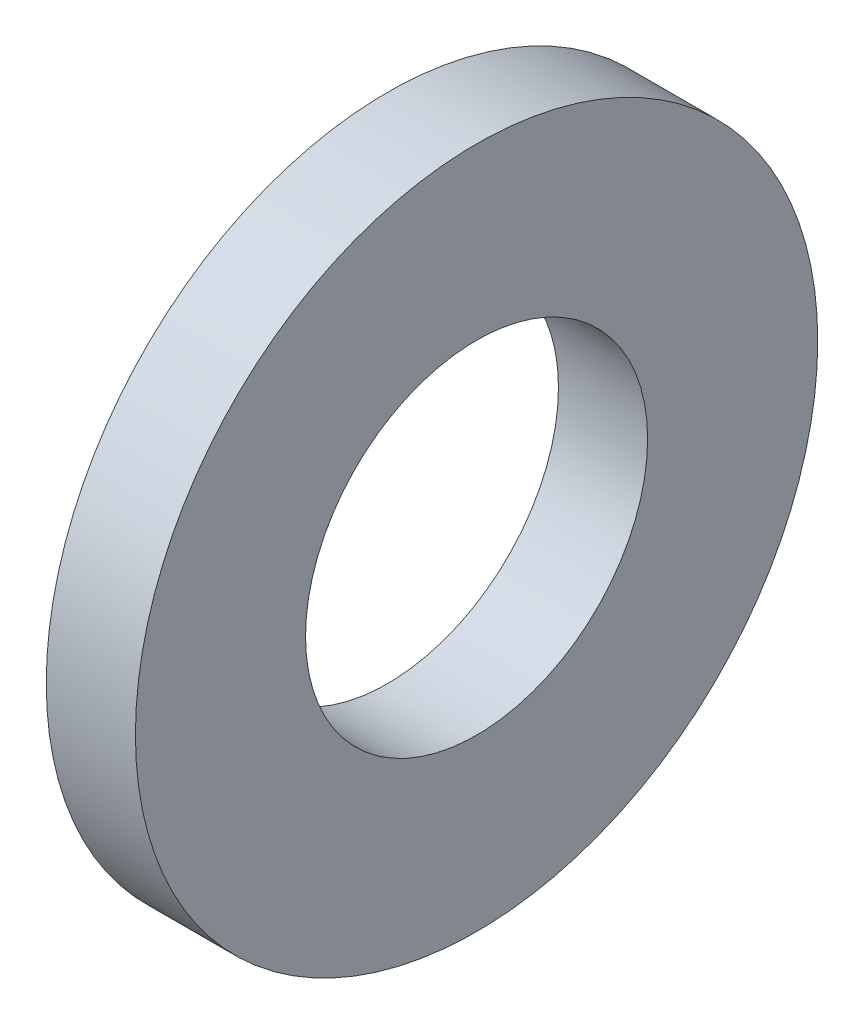
from build123d import *

# Parameters (mm, degrees)
SKETCH1_W = 1.2446
SKETCH1_H = 2.3749


with BuildPart() as part:
    # Sketch1 → Revolve1 (revolve)
    with BuildSketch(Plane(origin=(0, 0, 0), x_dir=(-1, 0, 0), z_dir=(0, 0, -1)), mode=Mode.PRIVATE) as revolve1_sk:
        with Locations((0.6223, 3.57505)):
            Rectangle(SKETCH1_W, SKETCH1_H)
    revolve(revolve1_sk.sketch.rotate(Axis((0, 0, 0), (-1, 0, 0)), 270), axis=Axis((0, 0, 0), (-1, 0, 0)))


solid = part.part
